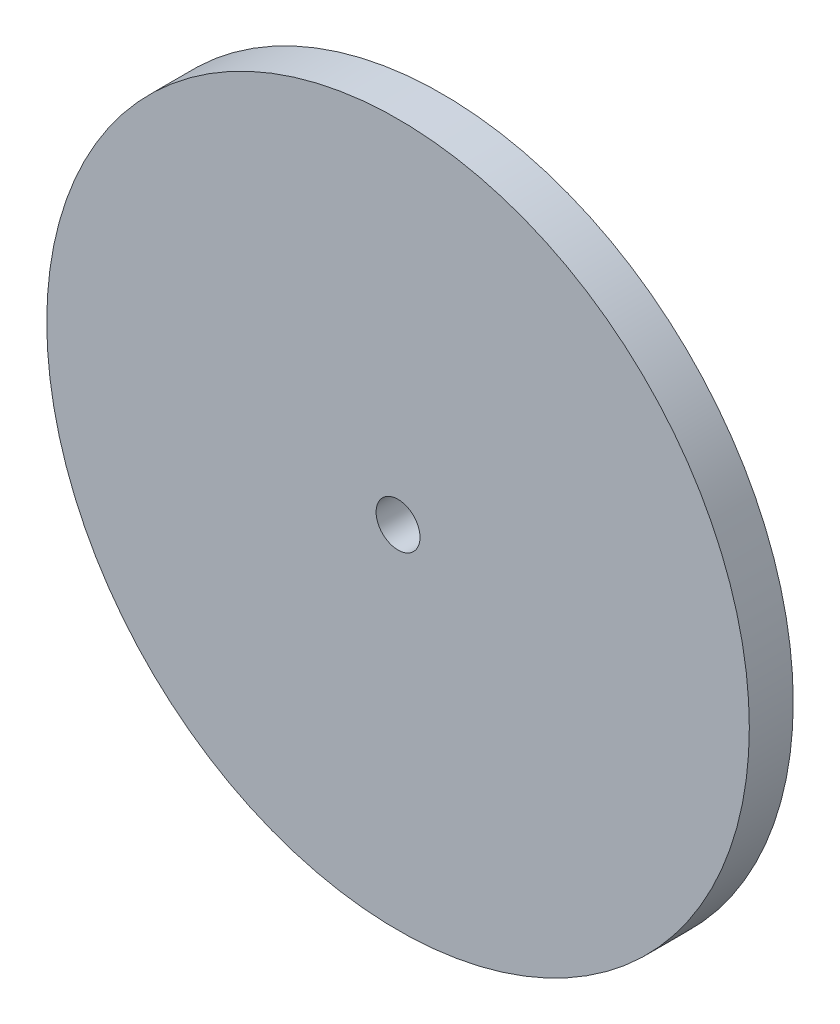
from build123d import *

# Parameters (mm, degrees)
SKETCH1_R           = 50.8
SKETCH1_R_2         = 3.175
BOSS_EXTRUDE1_DEPTH = 6.35


with BuildPart() as part:
    # Sketch1 → Boss-Extrude1 (new body)
    with BuildSketch(Plane.XY):
        Circle(SKETCH1_R)
        Circle(SKETCH1_R_2, mode=Mode.SUBTRACT)
    extrude(amount=BOSS_EXTRUDE1_DEPTH)


solid = part.part
